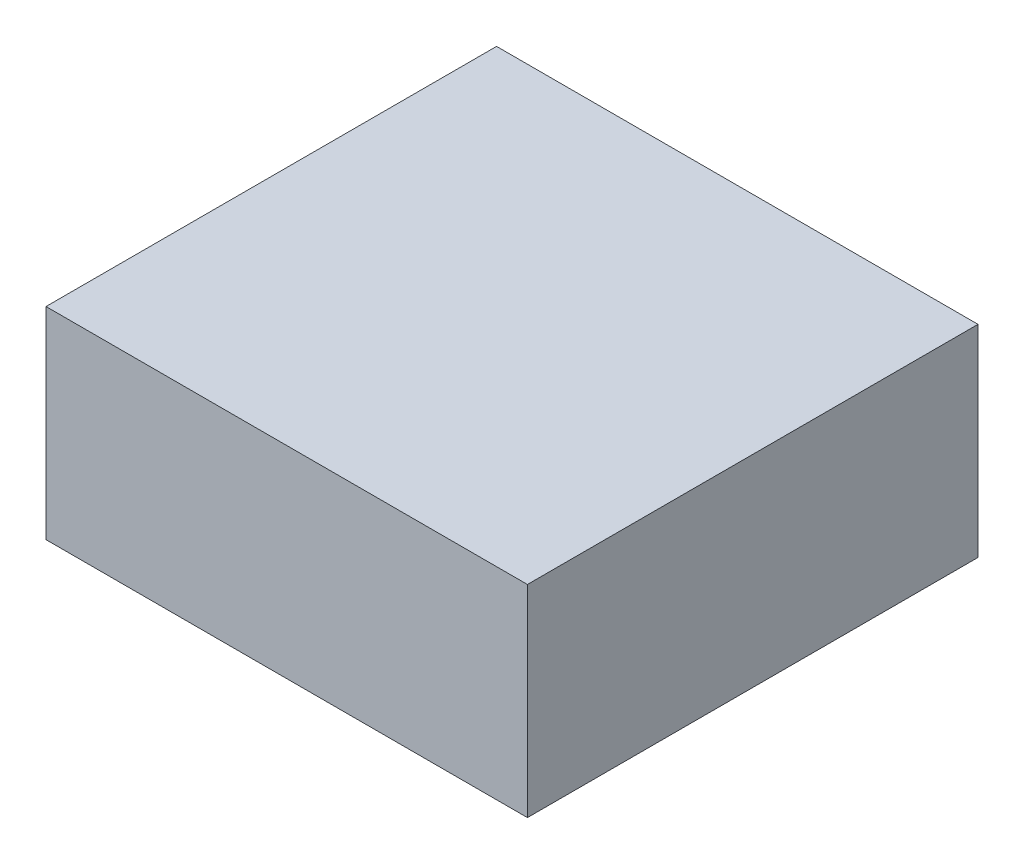
from build123d import *

# Parameters (mm, degrees)
SKETCH1_W           = 51.5
SKETCH1_H           = 48.2
BOSS_EXTRUDE1_DEPTH = 21.6


with BuildPart() as part:
    # Sketch1 → Boss-Extrude1 (new body)
    # profile 1 of 2: a face of its own
    with BuildSketch(Plane(origin=(0, 0, 0), x_dir=(1, 0, 0), z_dir=(0, 1, 0))):
        Rectangle(SKETCH1_W, SKETCH1_H)
        Polygon((9.95, 22.5), (24.15, 22.5), (24.15, -22.5), (-24.15, -22.5), (-24.15, 22.5), (0.95, 22.5), align=None, mode=Mode.SUBTRACT)
    # profile 2 of 2: a face of its own
    with BuildSketch(Plane(origin=(0, 0, 0), x_dir=(1, 0, 0), z_dir=(0, 1, 0))):
        Polygon((24.15, -22.5), (24.15, 22.5), (9.95, 22.5), (0.95, 22.5), (-24.15, 22.5), (-24.15, -22.5), align=None)
    extrude(amount=BOSS_EXTRUDE1_DEPTH)


solid = part.part
